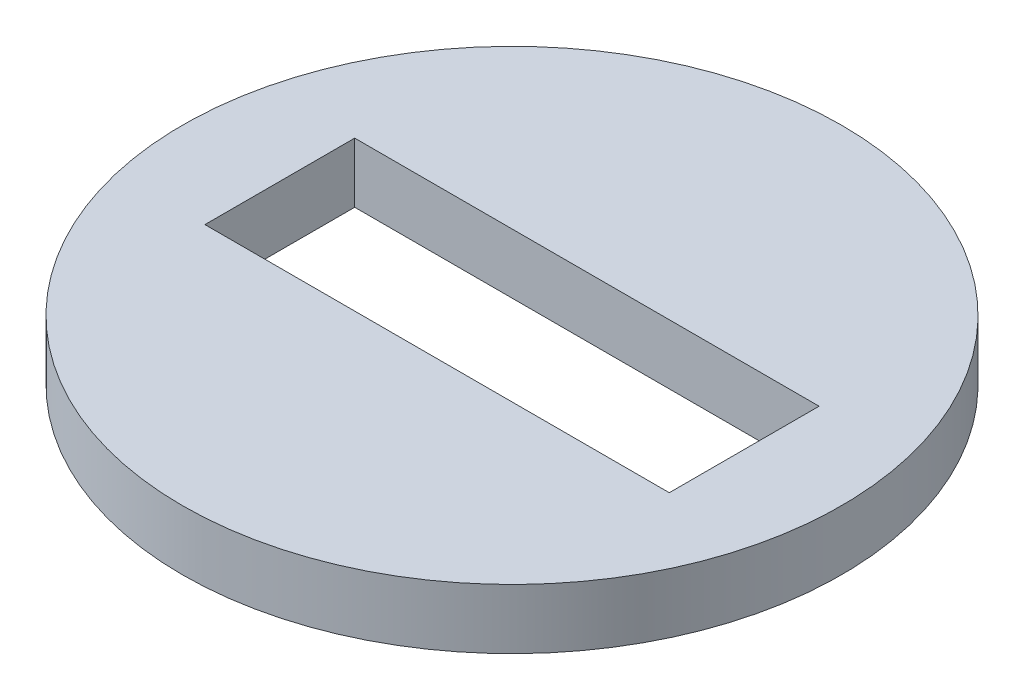
from build123d import *

# Parameters (mm, degrees)
SZKIC1_R                    = 11
SZKIC1_W                    = 15.5
SZKIC1_H                    = 5
DODANIE_WYCI_GNI_CIE1_DEPTH = 2


with BuildPart() as part:
    # Szkic1 → Dodanie-wyciągnięcie1 (new body)
    with BuildSketch(Plane(origin=(0, 0, 0), x_dir=(1, 0, 0), z_dir=(0, 1, 0))):
        with Locations(Location((0, 0, 0), (0, 0, 270))):
            Circle(SZKIC1_R)
        Rectangle(SZKIC1_W, SZKIC1_H, mode=Mode.SUBTRACT)
    extrude(amount=DODANIE_WYCI_GNI_CIE1_DEPTH)


solid = part.part
